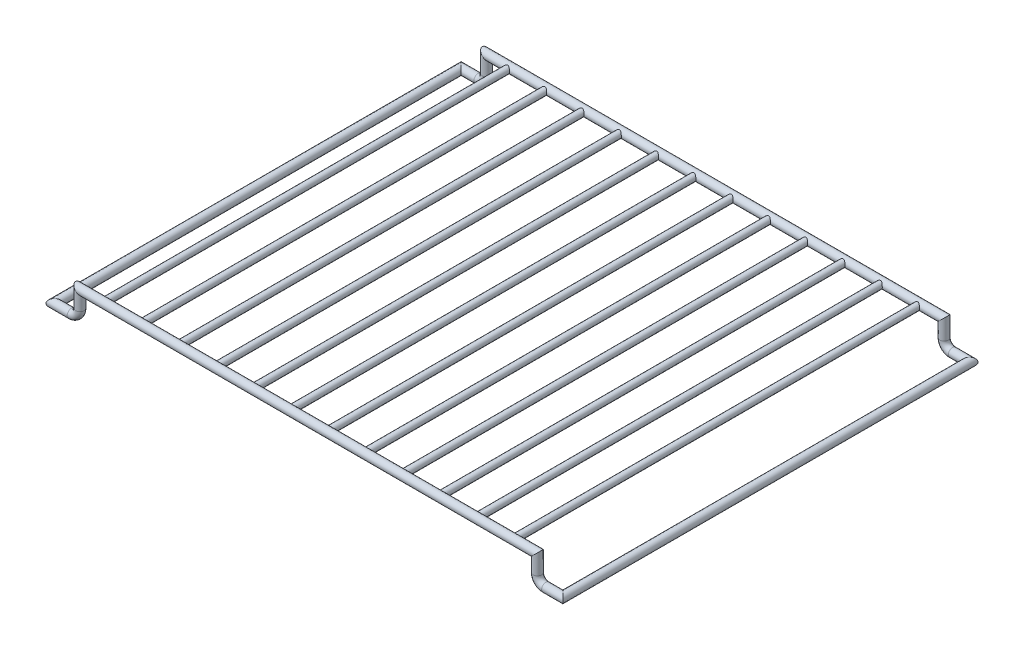
from build123d import *

# Parameters (mm, degrees)
SKETCH1_R                = 2.5
BOSS_EXTRUDE1_REACH      = 289
BOSS_EXTRUDE1_END_RADIUS = 2.5
SKETCH2_R                = 2
LPATTERN1_COUNT          = 6
LPATTERN1_PITCH          = 22


with BuildPart() as part:
    # Sweep1: sweep along a curve in space
    with BuildLine() as sweep1_path:
        Line((0, 0, 0), (135, 0, 0))
        Line((135, 0, 0), (135, -10, 0))
        ThreePointArc((135, -10, 0), (136.464466094, -13.535533906, 0), (140, -15, 0))
        Line((140, -15, 0), (150, -15, 0))
        Line((150, -15, 0), (150, -15, -240))
        Line((150, -15, -240), (140, -15, -240))
        ThreePointArc((140, -15, -240), (136.464466094, -13.535533906, -240), (135, -10, -240))
        Line((135, -10, -240), (135, 0, -240))
        Line((135, 0, -240), (0, 0, -240))
    # Sketch1 → Sweep1 (sweep)
    with BuildSketch(Plane(origin=(0, 0, 0), x_dir=(0, 0, -1), z_dir=(1, 0, 0))):
        Circle(SKETCH1_R)
    sweep(path=sweep1_path.line, transition=Transition.RIGHT)

    # Boss-Extrude1: up to this cylinder (the profile starts outside it)
    boss_extrude1_end = Plane(origin=(11, 0, -240), z_dir=(-1, 0, 0)) * Cylinder(BOSS_EXTRUDE1_END_RADIUS, 584, mode=Mode.PRIVATE)
    # Sketch2 → Boss-Extrude1 (add, up to the surface)
    with BuildSketch(Plane.XY, mode=Mode.PRIVATE) as boss_extrude1_sk1:
        with Locations((11, 0)):
            Circle(SKETCH2_R)
    boss_extrude1_tool1 = extrude(boss_extrude1_sk1.sketch, amount=-BOSS_EXTRUDE1_REACH, mode=Mode.PRIVATE) - boss_extrude1_end
    boss_extrude1 = boss_extrude1_tool1.solids().sort_by_distance((11, 0, 0))[0]
    add(boss_extrude1)

    # LPattern1: Boss-Extrude1 ×6
    with Locations(*[(i * LPATTERN1_PITCH, 0, 0) for i in range(1, LPATTERN1_COUNT)]):
        add(boss_extrude1)

    # Mirror1: part across plane


with BuildPart() as part_1:
    add(part.part)
    add(part.part.mirror(Plane(origin=(0, 0, -240), x_dir=(0, 0, 1), z_dir=(-1, 0, 0))))


solid = part_1.part
